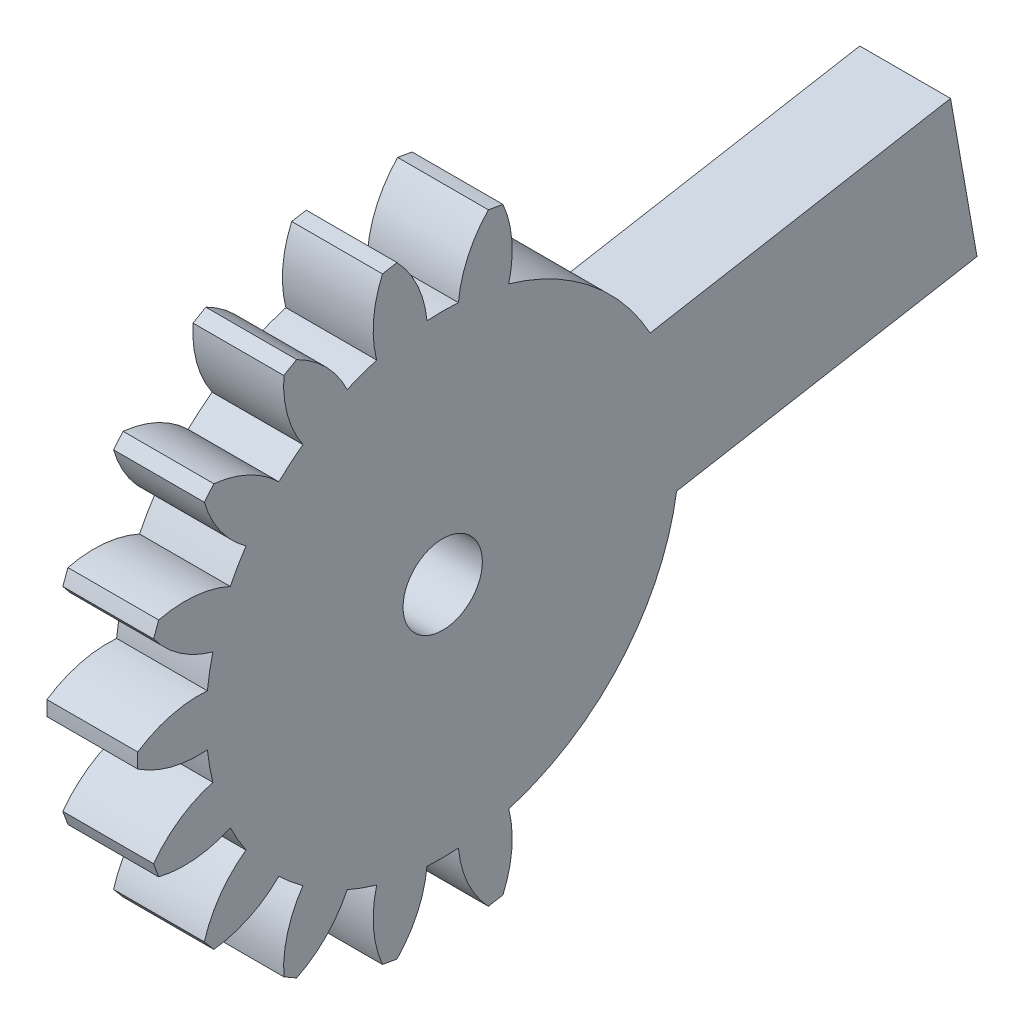
from build123d import *

# Parameters (mm, degrees)
BASPROSKE_W                  = 3.175
BASPROSKE_H                  = 12.7
TOOTHCUT_DEPTH               = 19.238986403
TEETHCUTS_COUNT              = 18
TEETHCUTS_ANGLE              = 340
BORSKE_R                     = 1.5875
BORE_DEPTH                   = 50.8000508
CUT_EXTRUDE_THIN1_DEPTH      = 1
CUT_EXTRUDE_THIN1_DEPTH_BACK = 5.08
BOSS_EXTRUDE1_DEPTH          = 3.175
CUT_EXTRUDE2_REACH           = 27.742
SKETCH9_R                    = 1.651
SCALE1_SCALE_X               = 1
SCALE1_SCALE_Y               = 0.84
SCALE1_SCALE_Z               = 0.84


with BuildPart() as part:
    # BasProSke → Base-Revolve (revolve)
    with BuildSketch(Plane(origin=(0, 0, 0), x_dir=(1, 0, 0), z_dir=(0, 1, 0)), mode=Mode.PRIVATE) as base_revolve_sk:
        with Locations((1.5875, 6.35)):
            Rectangle(BASPROSKE_W, BASPROSKE_H)
    revolve(base_revolve_sk.sketch.rotate(Axis((-10, 0, 0), (1, 0, 0)), 180), axis=Axis((-10, 0, 0), (1, 0, 0)))

    # TooCutSke → ToothCut (cut, through all)
    with BuildSketch(Plane(origin=(0, 0, 0), x_dir=(0, 0, -1), z_dir=(1, 0, 0))):
        with BuildLine():
            ThreePointArc((0.653663469, 9.833498417), (0, 9.8552), (-0.653663469, 9.833498417))
            ThreePointArc((-0.653663469, 9.833498417), (-1.05484238, 11.314407704), (-1.923354389, 12.579209556))
            ThreePointArc((-1.923354389, 12.579209556), (0, 12.7254), (1.923354389, 12.579209556))
            ThreePointArc((1.923354389, 12.579209556), (1.05484238, 11.314407704), (0.653663469, 9.833498417))
        make_face()
    toothcut = extrude(amount=TOOTHCUT_DEPTH, mode=Mode.SUBTRACT)

    # TeethCuts: ToothCut ×18 about axis
    teethcuts_axis = Axis((-10, 0, 0), (1, 0, 0))
    for i in range(1, TEETHCUTS_COUNT):
        add(toothcut.rotate(teethcuts_axis, i * TEETHCUTS_ANGLE / (TEETHCUTS_COUNT - 1)), mode=Mode.SUBTRACT)

    # BorSke → Bore (cut, symmetric)
    with BuildSketch(Plane(origin=(0, 0, 0), x_dir=(0, 0, -1), z_dir=(1, 0, 0))):
        with Locations(Location((0, 0, 0), (0, 0, 180))):
            Circle(BORSKE_R)
    extrude(amount=BORE_DEPTH, both=True, mode=Mode.SUBTRACT)

    # Sketch7 → Cut-Extrude-Thin1 (cut, two sides: drawn at the far end of the back side and taken through both)
    with BuildSketch(Plane.ZY.offset(-CUT_EXTRUDE_THIN1_DEPTH_BACK)):
        with BuildLine():
            Line((-10.823936545, 10.290898732), (-25.264431922, 12.837147681))
            Line((-25.264431922, 12.837147681), (-28.131363335, -3.422028321))
            Line((-28.131363335, -3.422028321), (-13.690867959, -5.968277271))
            ThreePointArc((-13.690867959, -5.968277271), (-11.782416361, -9.177955314), (-9.137407483, -11.813889433))
            Line((-9.137407483, -11.813889433), (-10.123749891, -15.359323522))
            ThreePointArc((-10.123749891, -15.359323522), (18.392184669, -0.355912967), (-9.521946872, 15.739493597))
            Line((-9.521946872, 15.739493597), (-8.708557038, 12.133475733))
            ThreePointArc((-8.708557038, 12.133475733), (-9.809604931, 11.261964755), (-10.823936545, 10.290898732))
        make_face()
        with BuildLine():
            Line((-8.636682816, 4.746859697), (-21.143741279, 6.952191553))
            Line((-21.143741279, 6.952191553), (-22.246407207, 0.698662322))
            Line((-22.246407207, 0.698662322), (-9.739348744, -1.506669535))
            ThreePointArc((-9.739348744, -1.506669535), (-7.549024322, -6.335392555), (-3.17353646, -9.330253661))
            Line((-3.17353646, -9.330253661), (-4.102105036, -12.668018169))
            ThreePointArc((-4.102105036, -12.668018169), (13.313553301, -0.235050135), (-3.652381497, 12.804923251))
            Line((-3.652381497, 12.804923251), (-2.889344669, 9.422136405))
            ThreePointArc((-2.889344669, 9.422136405), (-6.219073923, 7.64513483), (-8.636682816, 4.746859697))
        make_face(mode=Mode.SUBTRACT)
    extrude(amount=CUT_EXTRUDE_THIN1_DEPTH + CUT_EXTRUDE_THIN1_DEPTH_BACK, mode=Mode.SUBTRACT)

    # Sketch8 → Boss-Extrude1 (add)
    with BuildSketch(Plane.ZY):
        Polygon((-21.143741279, 6.952191553), (-22.246407207, 0.698662322), (-9.739348744, -1.506669535), (-8.636682816, 4.746859697), align=None)
    extrude(amount=-BOSS_EXTRUDE1_DEPTH)

    # Sketch9 → Cut-Extrude2 (cut, up to next)
    with BuildSketch(Plane.ZY, mode=Mode.PRIVATE) as cut_extrude2_sk1:
        Circle(SKETCH9_R)
    cut_extrude2_tool1 = extrude(cut_extrude2_sk1.sketch, amount=-CUT_EXTRUDE2_REACH, mode=Mode.PRIVATE) & part.part
    add(cut_extrude2_tool1.solids().sort_by_distance((0, 0, 0))[0], mode=Mode.SUBTRACT)


with BuildPart() as part_1:
    # Scale1: scaled about (1.5875, 0.50323633, -2.169084726)
    add(part.part.scale((SCALE1_SCALE_X, SCALE1_SCALE_Y, SCALE1_SCALE_Z), about=(1.5875, 0.50323633, -2.169084726)))


solid = part_1.part
